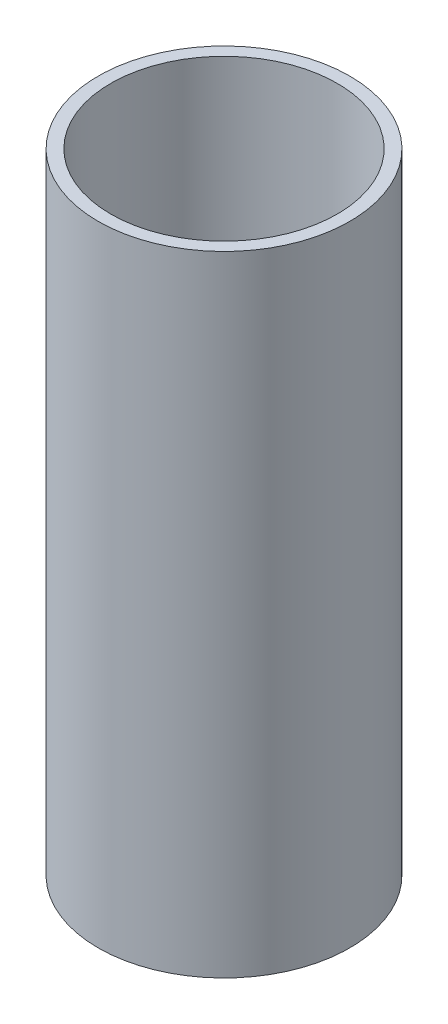
from build123d import *

# Parameters (mm, degrees)
SKETCH_1_R      = 20
SKETCH_1_R_2    = 18
EXTRUDE_1_DEPTH = 100


with BuildPart() as part:
    # 草图1 → 凸台-拉伸1 (new body)
    with BuildSketch(Plane(origin=(0, 0, 0), x_dir=(1, 0, 0), z_dir=(0, 1, 0))):
        with Locations(Location((0, 0, 0), (0, 0, 270))):
            Circle(SKETCH_1_R)
        with Locations(Location((0, 0, 0), (0, 0, 270))):
            Circle(SKETCH_1_R_2, mode=Mode.SUBTRACT)
    extrude(amount=EXTRUDE_1_DEPTH)


solid = part.part
